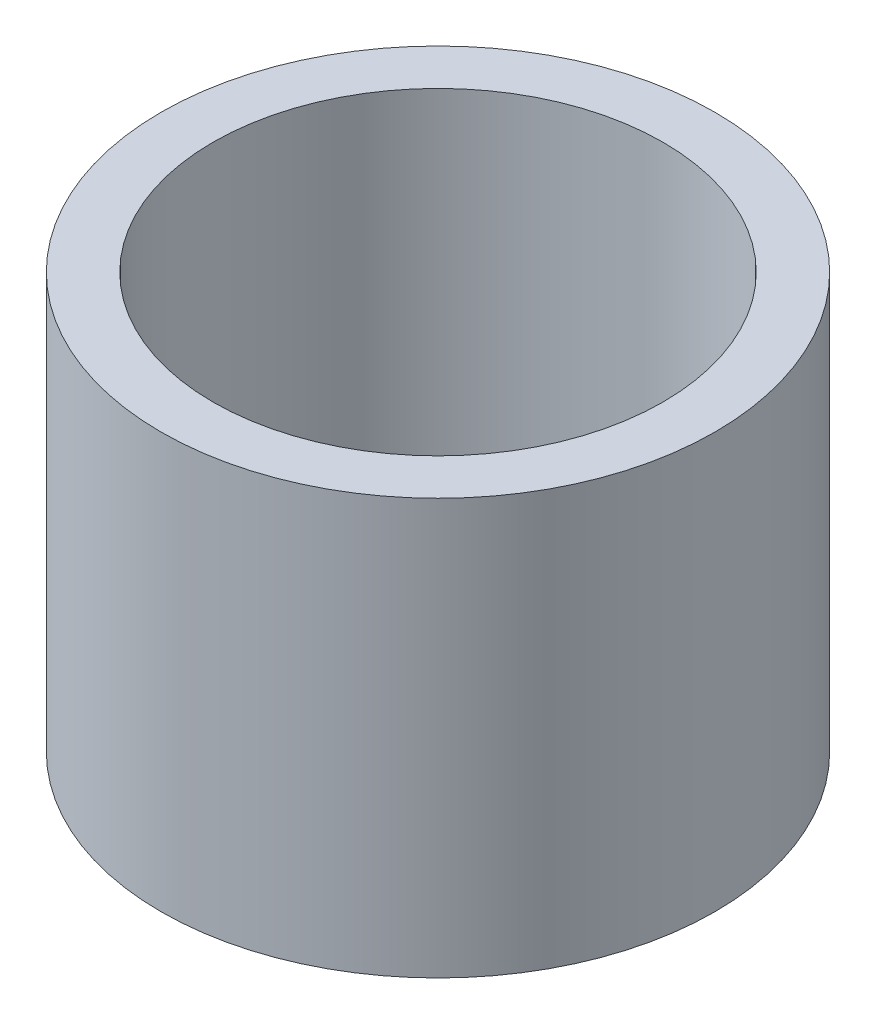
from build123d import *

# Parameters (mm, degrees)
SKETCH1_R           = 40
SKETCH1_R_2         = 32.5
BOSS_EXTRUDE1_DEPTH = 60


with BuildPart() as part:
    # Sketch1 → Boss-Extrude1 (new body)
    with BuildSketch(Plane(origin=(0, 0, 0), x_dir=(1, 0, 0), z_dir=(0, 1, 0))):
        with Locations(Location((0, 0, 0), (0, 0, 90))):
            Circle(SKETCH1_R)
        with Locations(Location((0, 0, 0), (0, 0, 90))):
            Circle(SKETCH1_R_2, mode=Mode.SUBTRACT)
    extrude(amount=BOSS_EXTRUDE1_DEPTH)


solid = part.part
